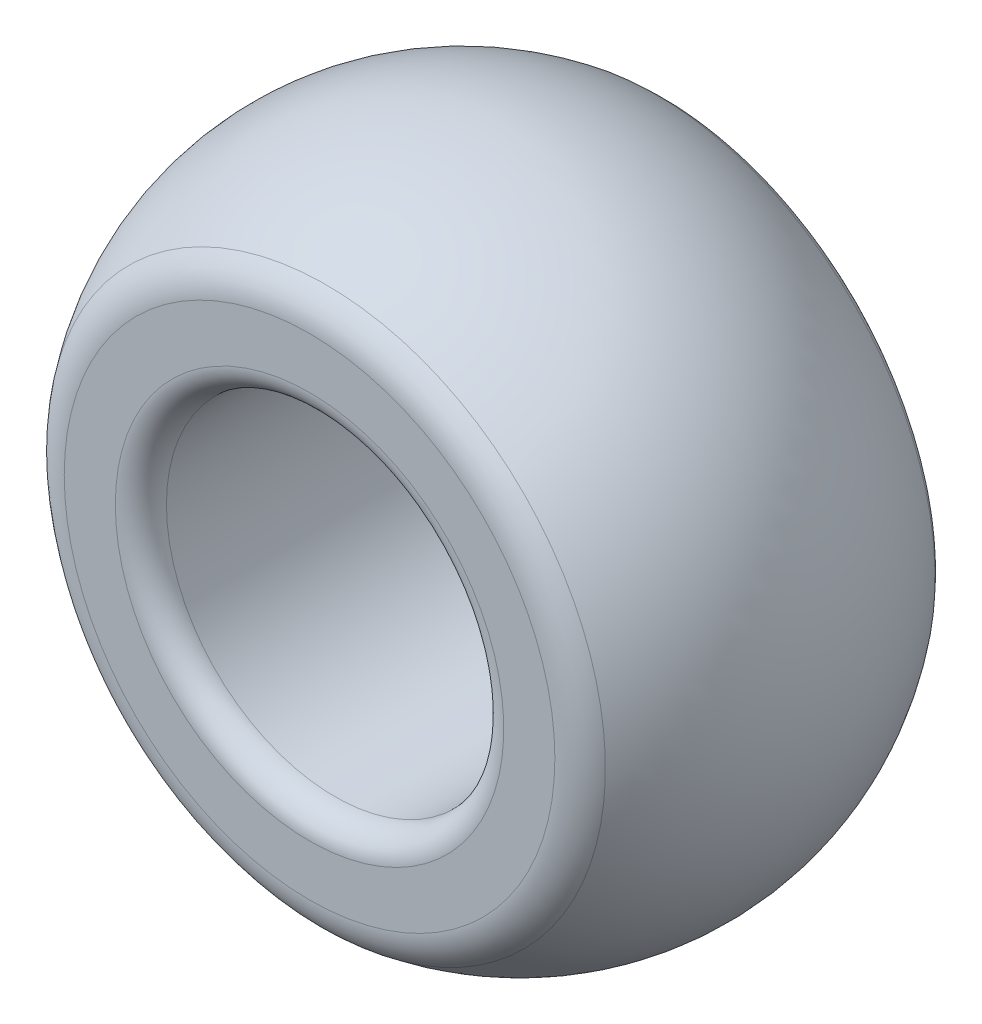
from build123d import *


with BuildPart() as part:
    # Sketch1 → Revolve2 (revolve)
    with BuildSketch(Plane(origin=(0, 0, 0), x_dir=(1, 0, 0), z_dir=(0, 1, 0))):
        with BuildLine():
            ThreePointArc((-18.853923819, 1.88696354), (-19.187356805, 0.906600667), (-18.853923819, -0.073762206))
            ThreePointArc((-18.853923819, -0.073762206), (-18.764801529, -0.146771194), (-18.65259451, -0.172899333))
            Line((-18.65259451, -0.172899333), (-18.348771106, -0.172899333))
            ThreePointArc((-18.348771106, -0.172899333), (-18.241280763, -0.128375375), (-18.196756805, -0.020885032))
            Line((-18.196756805, -0.020885032), (-18.196756805, 1.834086366))
            ThreePointArc((-18.196756805, 1.834086366), (-18.241280763, 1.941576709), (-18.348771106, 1.986100667))
            Line((-18.348771106, 1.986100667), (-18.65259451, 1.986100667))
            ThreePointArc((-18.65259451, 1.986100667), (-18.764801529, 1.959972528), (-18.853923819, 1.88696354))
        make_face()
    revolve(axis=Axis((-17.193456805, 0, -1.490109452), (0, 0, 1)))


solid = part.part
